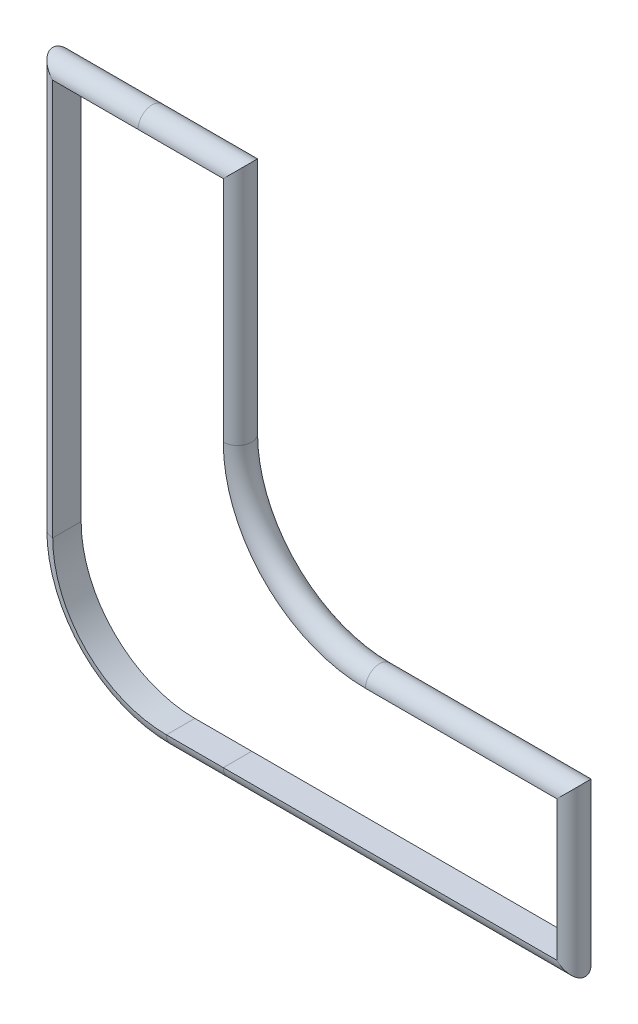
from build123d import *


with BuildPart() as part:
    # Sweep1: sweep along a path in Sketch2
    with BuildLine(Plane.XY) as sweep1_path:
        Line((-0.15, 0.35), (0.15, 0.35))
        Line((0.15, 0.35), (0.15, -0.051374847))
        ThreePointArc((0.15, -0.051374847), (0.223223305, -0.228151543), (0.4, -0.301374847))
        Line((0.4, -0.301374847), (0.736808624, -0.301374847))
        Line((0.736808624, -0.301374847), (0.736808624, -0.547273546))
        Line((0.736808624, -0.547273546), (0.15, -0.547273546))
        Line((0.15, -0.547273546), (0.05, -0.547273546))
        ThreePointArc((0.05, -0.547273546), (-0.091421356, -0.488694902), (-0.15, -0.347273546))
        Line((-0.15, -0.347273546), (-0.15, 0.35))
    # Sketch1 → Sweep1 (sweep)
    with BuildSketch(Plane(origin=(0, 0, 0), x_dir=(0, 0, -1), z_dir=(1, 0, 0))):
        with BuildLine():
            Line((-0.025, 0.35), (0.025, 0.35))
            ThreePointArc((0.025, 0.35), (0, 0.375), (-0.025, 0.35))
        make_face()
    sweep(path=sweep1_path.line, transition=Transition.RIGHT)


solid = part.part
